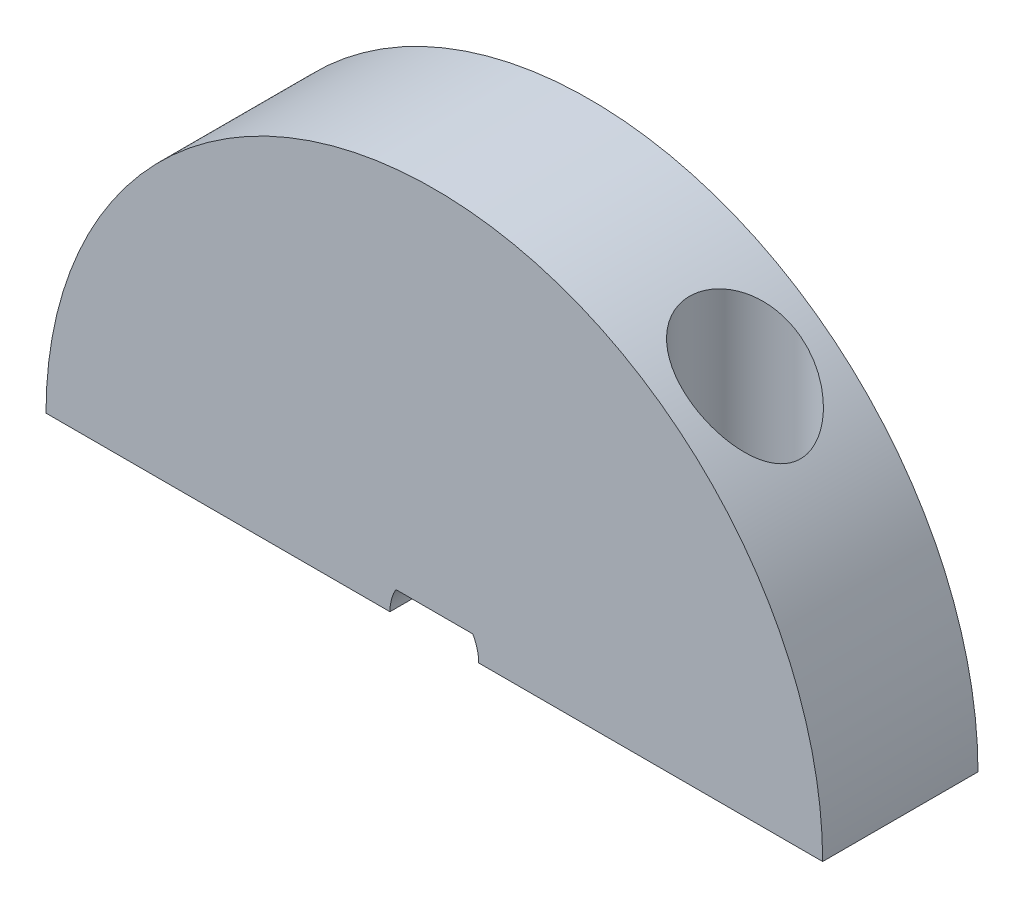
from build123d import *
from build123d.topology import SkipClean

# Parameters (mm, degrees)
BOSS_EXTRU_1_DEPTH      = 5
BOSS_EXTRU_3_START      = 2
BOSS_EXTRU_3_DEPTH      = 2
ESQUISSE5_R             = 0.5
ESQUISSE5_R_2           = 2.5
ENL_V_MAT_EXTRU_1_DEPTH = 2
ESQUISSE7_R             = 2.5
ENL_V_MAT_EXTRU_2_DEPTH = 24.906066176


with BuildPart() as part:
    # Esquisse1 → Boss.-Extru.1 (new body)
    with BuildSketch(Plane.XY):
        with BuildLine():
            Line((-1.732050808, 1), (1.732050808, 1))
            ThreePointArc((1.732050808, 1), (1.931851653, 0.51763809), (2, 0))
            Line((2, 0), (17.5, 0))
            ThreePointArc((17.5, 0), (0, 17.5), (-17.5, 0))
            Line((-17.5, 0), (-2, 0))
            ThreePointArc((-2, 0), (-1.931851653, 0.51763809), (-1.732050808, 1))
        make_face()
    extrude(amount=BOSS_EXTRU_1_DEPTH)

    # Esquisse3 → Boss.-Extru.3 (add)
    with SkipClean():  # the faces are left unmerged after this step: merging them gives an invalid solid
        with BuildSketch(Plane(origin=(0, 0, 0), x_dir=(-1, 0, 0), z_dir=(0, 0, -1)).offset(BOSS_EXTRU_3_START)):
            with BuildLine():
                Line((0, 2), (0, 17.5))
                ThreePointArc((0, 17.5), (-12.374368671, 12.374368671), (-17.5, 0))
                Line((-17.5, 0), (-2, 0))
                ThreePointArc((-2, 0), (-1.931851653, 0.51763809), (-1.732050808, 1))
                ThreePointArc((-1.732050808, 1), (-1, 1.732050808), (0, 2))
            make_face()
            with BuildLine():
                ThreePointArc((17.5, 0), (12.374368671, 12.374368671), (0, 17.5))
                Line((0, 17.5), (0, 2))
                ThreePointArc((0, 2), (1, 1.732050808), (1.732050808, 1))
                ThreePointArc((1.732050808, 1), (1.931851653, 0.51763809), (2, 0))
                Line((2, 0), (17.5, 0))
            make_face()
        extrude(amount=-BOSS_EXTRU_3_DEPTH)

    # Esquisse5 → Enlèv. mat.-Extru.1 (cut)
    with SkipClean():  # the faces are left unmerged after this step: merging them gives an invalid solid
        with BuildSketch(Plane.XZ):
            with Locations(Location((-10.5, 1.5, 0), (0, 0, 270))):
                Circle(ESQUISSE5_R)
            with Locations(Location((10.5, 1.5, 0), (0, 0, 270))):
                Circle(ESQUISSE5_R_2)
        extrude(amount=-ENL_V_MAT_EXTRU_1_DEPTH, mode=Mode.SUBTRACT)

    # Esquisse7 → Enlèv. mat.-Extru.2 (cut, through all)
    with SkipClean():  # the faces are left unmerged after this step: merging them gives an invalid solid
        with BuildSketch(Plane.XZ.offset(-2)):
            with Locations(Location((10.5, 1.5, 0), (0, 0, 270))):
                Circle(ESQUISSE7_R)
        extrude(amount=-ENL_V_MAT_EXTRU_2_DEPTH, mode=Mode.SUBTRACT)


solid = part.part
